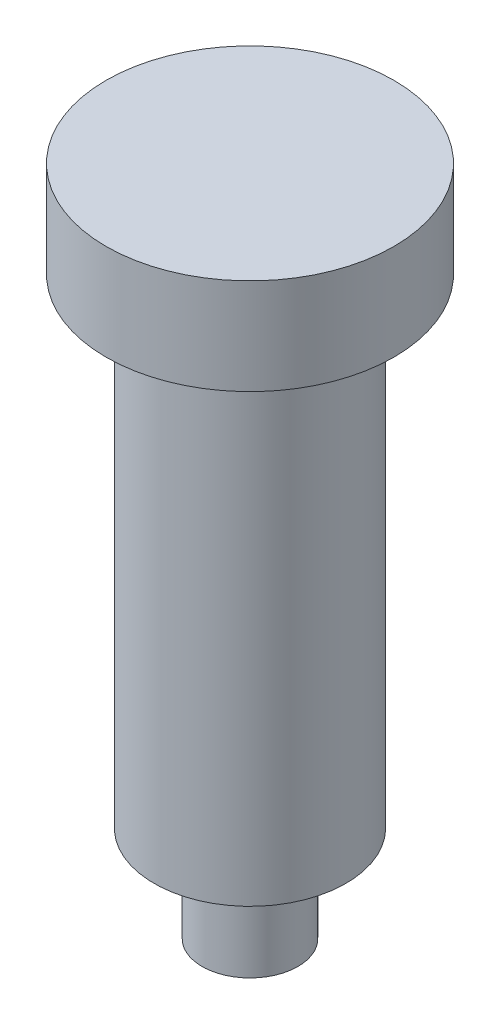
from build123d import *


with BuildPart() as part:
    # Sketch1 → Revolve1 (revolve)
    with BuildSketch(Plane.XY, mode=Mode.PRIVATE) as revolve1_sk:
        Polygon((-0.638297872, 15.957446809), (5.361702128, 15.957446809), (5.361702128, 11.957446809), (3.361702128, 11.957446809), (3.361702128, -8.042553191), (1.361702128, -8.042553191), (1.361702128, -12.042553191), (-0.638297872, -12.042553191), align=None)
    revolve(revolve1_sk.sketch.rotate(Axis((-0.638297872, -12.042553191, 0), (0, 1, 0)), 90), axis=Axis((-0.638297872, -12.042553191, 0), (0, 1, 0)))


solid = part.part
